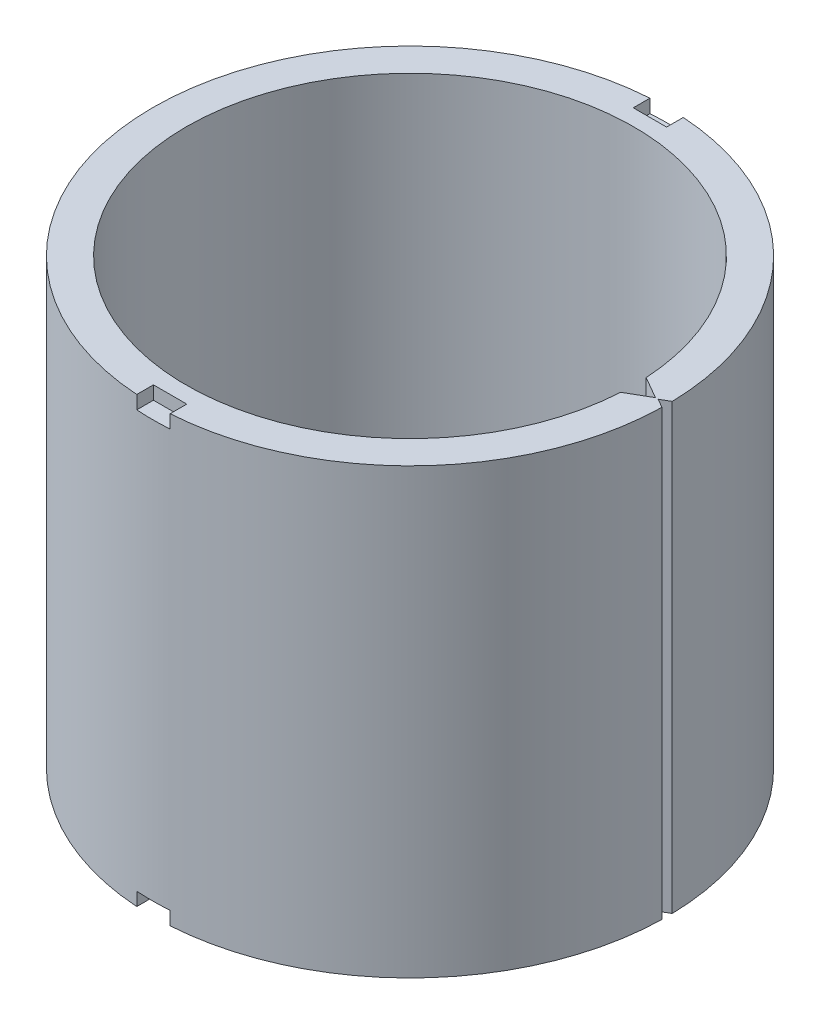
from build123d import *

# Parameters (mm, degrees)
SKETCH2_W               = 3.175
SKETCH2_H               = 42.221697185
SKETCH3_W               = 3.175
SKETCH3_H               = 3.175
CUT_EXTRUDE1_DEPTH      = 1.27
CUT_EXTRUDE2_DEPTH      = 41.54574875
CUT_EXTRUDE2_DEPTH_BACK = 41.54574875


with BuildPart() as part:
    # Sketch2 → Revolve1 (revolve)
    with BuildSketch(Plane.XY, mode=Mode.PRIVATE) as revolve1_sk:
        with Locations((22.889936685, 21.110848593)):
            Rectangle(SKETCH2_W, SKETCH2_H)
    revolve(revolve1_sk.sketch.rotate(Axis((0, 38.094197185, 0), (0, -1, 0)), 180), axis=Axis((0, 38.094197185, 0), (0, -1, 0)))

    # Sketch3 → Cut-Extrude1 (cut)
    with BuildSketch(Plane(origin=(0, 42.221697185, 0), x_dir=(1, 0, 0), z_dir=(0, 1, 0))):
        with Locations((0, 24.425903267)):
            Rectangle(SKETCH3_W, SKETCH3_H)
        with Locations((0, -24.425903267)):
            Rectangle(SKETCH3_W, SKETCH3_H)
    cut_extrude1 = extrude(amount=-CUT_EXTRUDE1_DEPTH, mode=Mode.SUBTRACT)

    # Mirror1: Cut-Extrude1 across plane
    add(cut_extrude1.mirror(Plane.ZX.offset(21.110848593)), mode=Mode.SUBTRACT)

    # Sketch4 → Cut-Extrude2 (cut, two sides: drawn at the far end of the back side and taken through both)
    with BuildSketch(Plane(origin=(0, 21.110848593, 0), x_dir=(1, 0, 0), z_dir=(0, 1, 0)).offset(-CUT_EXTRUDE2_DEPTH_BACK)):
        with BuildLine():
            Line((24.472510779, 0.491042627), (23.622, 0))
            Line((23.622, 0), (24.472510779, -0.491042627))
            ThreePointArc((24.472510779, -0.491042627), (24.477436685, 0), (24.472510779, 0.491042627))
        make_face()
        with BuildLine():
            Line((21.26790239, 1.21249192), (23.368, 0))
            Line((23.368, 0), (21.26790239, -1.21249192))
            ThreePointArc((21.26790239, -1.21249192), (21.302436685, 0), (21.26790239, 1.21249192))
        make_face()
    extrude(amount=CUT_EXTRUDE2_DEPTH + CUT_EXTRUDE2_DEPTH_BACK, mode=Mode.SUBTRACT)


solid = part.part
